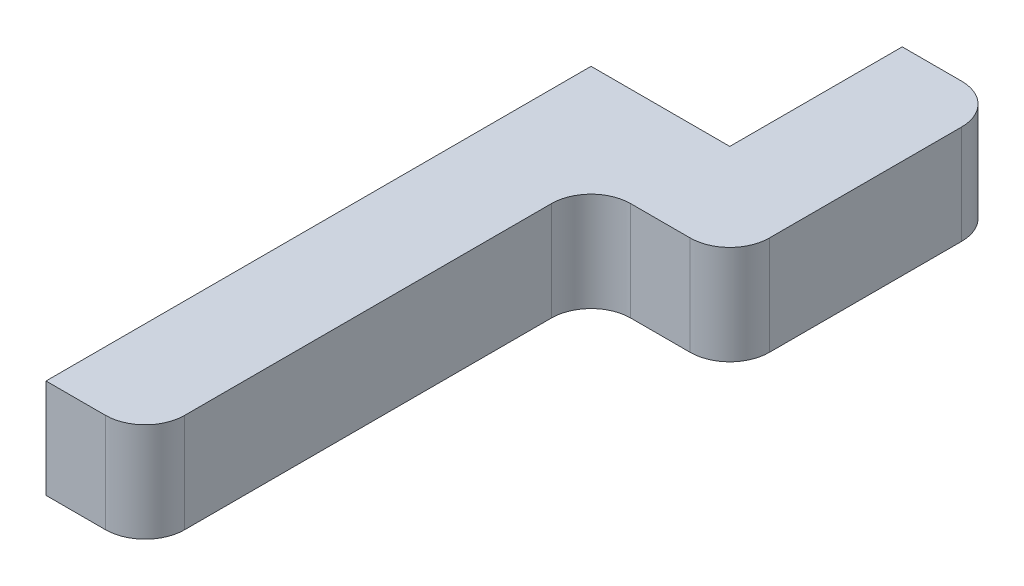
from build123d import *

# Parameters (mm, degrees)
BOSS_EXTRUDE1_DEPTH = 5


with BuildPart() as part:
    # Sketch1 → Boss-Extrude1 (new body)
    with BuildSketch(Plane(origin=(0, 0, 0), x_dir=(1, 0, 0), z_dir=(0, 1, 0))):
        with BuildLine():
            Line((7, 36.2), (10, 36.2))
            ThreePointArc((10, 36.2), (11.414213562, 35.614213562), (12, 34.2))
            Line((12, 34.2), (12, 24.5))
            ThreePointArc((12, 24.5), (11.414213562, 23.085786438), (10, 22.5))
            Line((10, 22.5), (7, 22.5))
            ThreePointArc((7, 22.5), (5.585786438, 21.914213562), (5, 20.5))
            Line((5, 20.5), (5, 2))
            ThreePointArc((5, 2), (4.414213562, 0.585786438), (3, 0))
            Line((3, 0), (0, 0))
            Line((0, 0), (0, 27.5))
            Line((0, 27.5), (7, 27.5))
            Line((7, 27.5), (7, 36.2))
        make_face()
    extrude(amount=BOSS_EXTRUDE1_DEPTH)


solid = part.part
